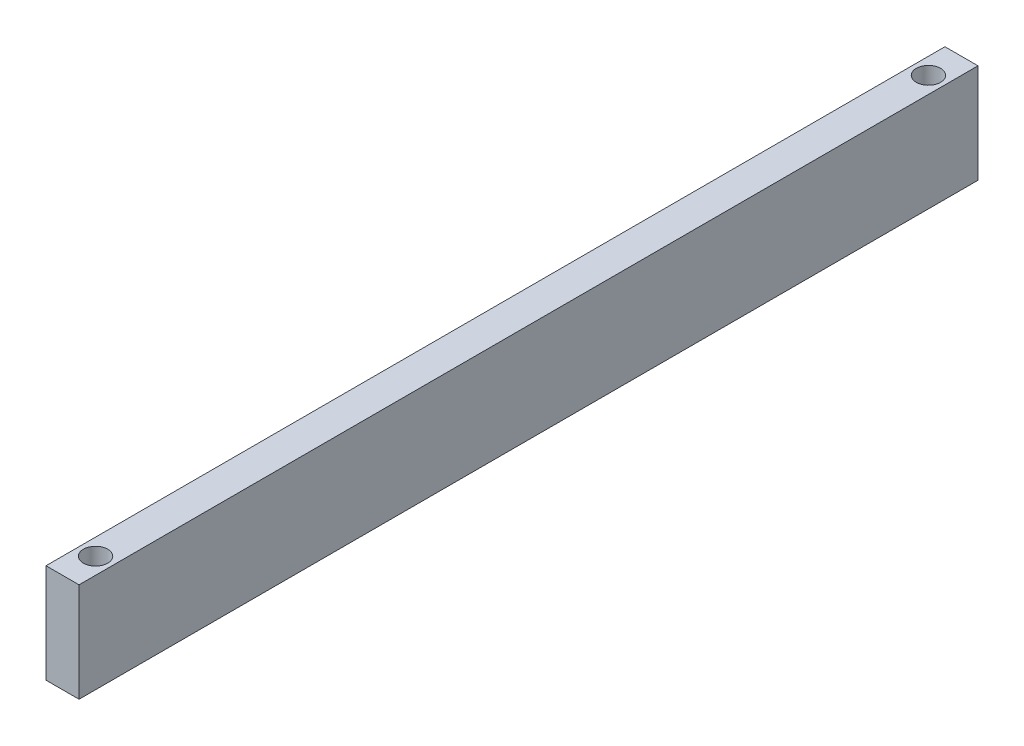
from build123d import *

# Parameters (mm, degrees)
SKETCH1_W           = 6.35
SKETCH1_H           = 19.05
BOSS_EXTRUDE1_DEPTH = 172.72
SKETCH2_R           = 2.3368
CUT_EXTRUDE4_DEPTH  = 174.883361481


with BuildPart() as part:
    # Sketch1 → Boss-Extrude1 (new body)
    with BuildSketch(Plane.XY):
        with Locations((-3.175, 9.525)):
            Rectangle(SKETCH1_W, SKETCH1_H)
    extrude(amount=BOSS_EXTRUDE1_DEPTH)

    # Sketch2 → Cut-Extrude4 (cut, through all)
    with BuildSketch(Plane(origin=(0, 19.05, 0), x_dir=(1, 0, 0), z_dir=(0, 1, 0))):
        with Locations(Location((-3.175, -166.37, 0), (0, 0, 270))):
            Circle(SKETCH2_R)
        with Locations(Location((-3.175, -6.35, 0), (0, 0, 270))):
            Circle(SKETCH2_R)
    extrude(amount=-CUT_EXTRUDE4_DEPTH, mode=Mode.SUBTRACT)


solid = part.part
